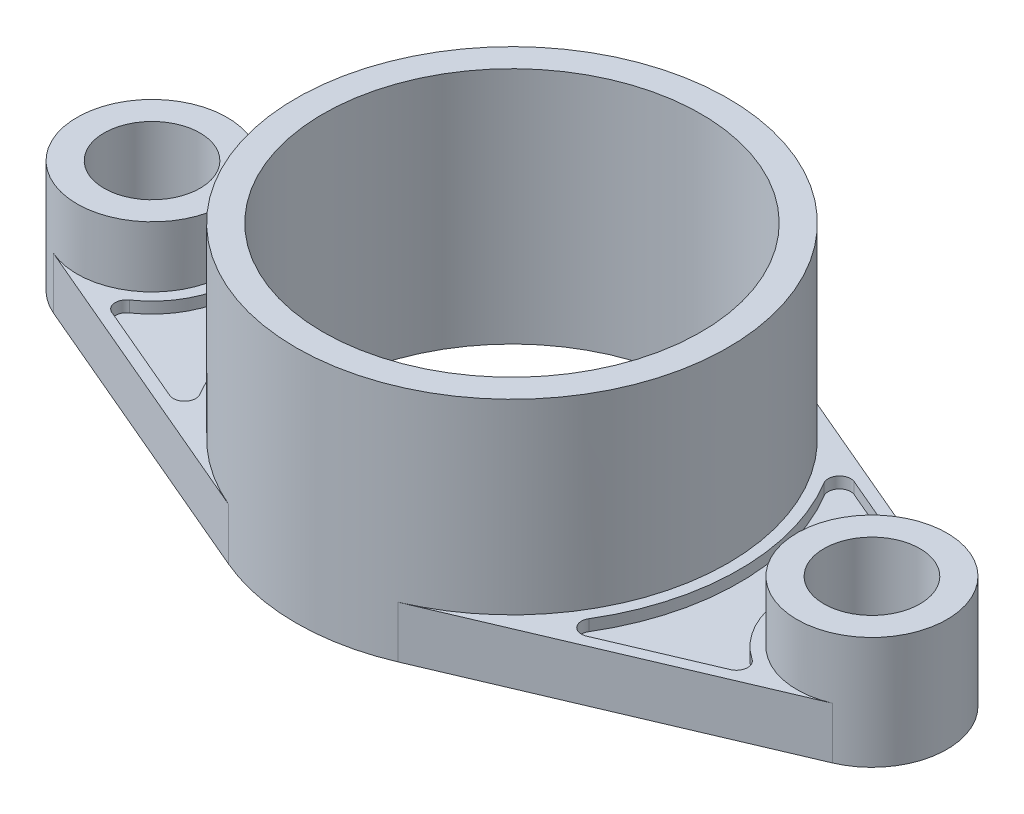
from build123d import *

# Parameters (mm, degrees)
SKETCH1_R           = 42
SKETCH1_R_2         = 10.666666667
BOSS_EXTRUDE1_DEPTH = 11.5
SKETCH1_3_R         = 16.666666667
SKETCH1_3_R_2       = 10.666666667
BOSS_EXTRUDE2_DEPTH = 25
SKETCH1_4_R         = 42
BOSS_EXTRUDE3_DEPTH = 53
CUT_EXTRUDE1_DEPTH  = 2.5


with BuildPart() as part:
    # Sketch1 → Boss-Extrude1 (new body)
    with BuildSketch(Plane(origin=(0, 0, 0), x_dir=(1, 0, 0), z_dir=(0, 1, 0))):
        with BuildLine():
            Line((-18.8, 44.165144628), (-86.527777778, 15.335119662))
            ThreePointArc((-86.527777778, 15.335119662), (-96.666666667, 0), (-86.527777778, -15.335119662))
            Line((-86.527777778, -15.335119662), (-18.8, -44.165144628))
            ThreePointArc((-18.8, -44.165144628), (0, -48), (18.8, -44.165144628))
            Line((18.8, -44.165144628), (86.527777778, -15.335119662))
            ThreePointArc((86.527777778, -15.335119662), (96.666666667, 0), (86.527777778, 15.335119662))
            Line((86.527777778, 15.335119662), (18.8, 44.165144628))
            ThreePointArc((18.8, 44.165144628), (0, 48), (-18.8, 44.165144628))
        make_face()
        Circle(SKETCH1_R, mode=Mode.SUBTRACT)
        with Locations((-80, 0)):
            Circle(SKETCH1_R_2, mode=Mode.SUBTRACT)
        with Locations((80, 0)):
            Circle(SKETCH1_R_2, mode=Mode.SUBTRACT)
    extrude(amount=BOSS_EXTRUDE1_DEPTH)

    # Sketch1<3> → Boss-Extrude2 (add)
    # profile 1 of 2: a face of its own
    with BuildSketch(Plane(origin=(0, 0, 0), x_dir=(1, 0, 0), z_dir=(0, 1, 0))):
        with Locations((-80, 0)):
            Circle(SKETCH1_3_R)
        with Locations((-80, 0)):
            Circle(SKETCH1_3_R_2, mode=Mode.SUBTRACT)
    # profile 2 of 2: a face of its own
    with BuildSketch(Plane(origin=(0, 0, 0), x_dir=(1, 0, 0), z_dir=(0, 1, 0))):
        with Locations((80, 0)):
            Circle(SKETCH1_3_R)
        with Locations((80, 0)):
            Circle(SKETCH1_3_R_2, mode=Mode.SUBTRACT)
    extrude(amount=BOSS_EXTRUDE2_DEPTH)

    # Sketch1<4> → Boss-Extrude3 (add)
    with BuildSketch(Plane(origin=(0, 0, 0), x_dir=(1, 0, 0), z_dir=(0, 1, 0))):
        with BuildLine():
            ThreePointArc((18.8, 44.165144628), (0, 48), (-18.8, 44.165144628))
            ThreePointArc((-18.8, 44.165144628), (-48, 0), (-18.8, -44.165144628))
            ThreePointArc((-18.8, -44.165144628), (0, -48), (18.8, -44.165144628))
            ThreePointArc((18.8, -44.165144628), (40.03998002, -26.472627372), (48, 0))
            ThreePointArc((48, 0), (40.03998002, 26.472627372), (18.8, 44.165144628))
        make_face()
        Circle(SKETCH1_4_R, mode=Mode.SUBTRACT)
    extrude(amount=BOSS_EXTRUDE3_DEPTH)

    # Sketch2 → Cut-Extrude1 (cut)
    with BuildSketch(Plane(origin=(0, 11.5, 0), x_dir=(1, 0, 0), z_dir=(0, 1, 0))):
        with BuildLine():
            Line((-68.749829189, -20.185673992), (-46.329311604, -29.72952886))
            ThreePointArc((-46.329311604, -29.72952886), (-43.461816215, -29.067618209), (-43.210987158, -26.135427849))
            ThreePointArc((-43.210987158, -26.135427849), (-50.5, 0), (-43.210987158, 26.135427849))
            ThreePointArc((-43.210987158, 26.135427849), (-43.461816215, 29.067618209), (-46.329311604, 29.72952886))
            Line((-46.329311604, 29.72952886), (-68.749829189, 20.185673992))
            ThreePointArc((-68.749829189, 20.185673992), (-70.258507425, 18.131633045), (-69.181739923, 15.821705345))
            ThreePointArc((-69.181739923, 15.821705345), (-60.833333333, 0), (-69.181739923, -15.821705345))
            ThreePointArc((-69.181739923, -15.821705345), (-70.258507425, -18.131633045), (-68.749829189, -20.185673992))
        make_face()
    cut_extrude1 = extrude(amount=-CUT_EXTRUDE1_DEPTH, mode=Mode.SUBTRACT)

    # Mirror1: Cut-Extrude1 across plane
    add(cut_extrude1.mirror(Plane(origin=(0, 0, 0), x_dir=(0, 0, 1), z_dir=(1, 0, 0))), mode=Mode.SUBTRACT)


solid = part.part
